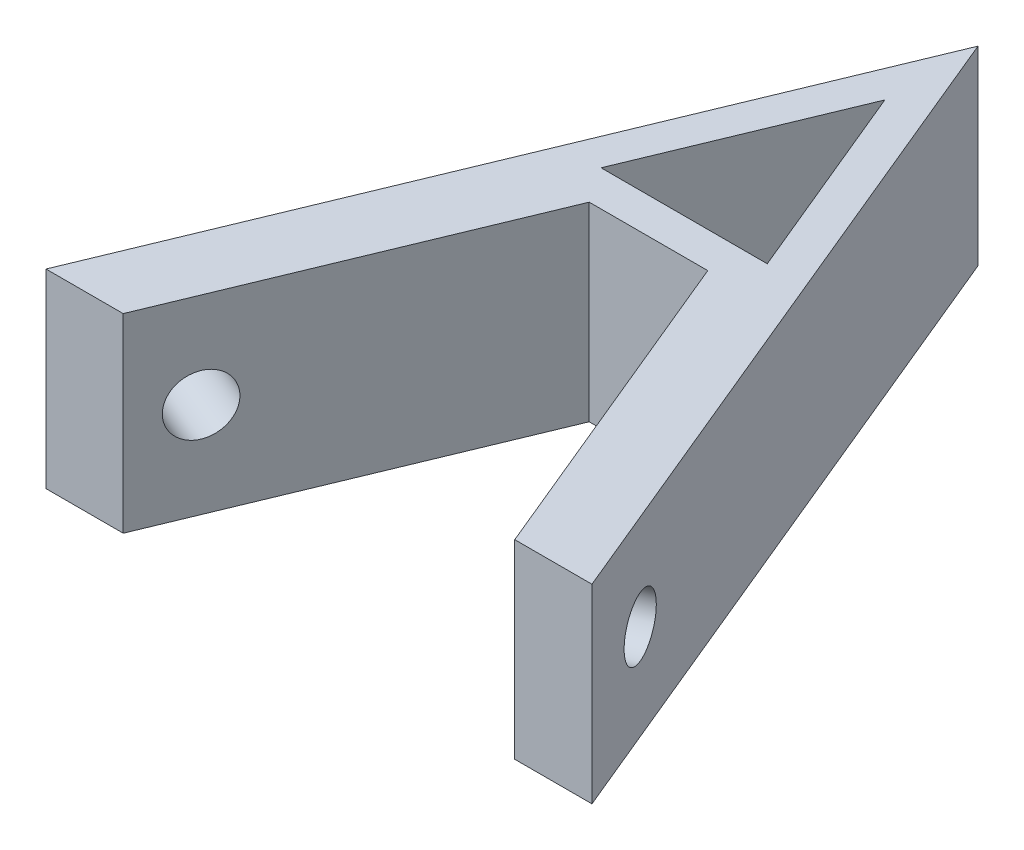
from build123d import *

# Parameters (mm, degrees)
BOSS_EXTRUDE1_DEPTH = 16
CUT_EXTRUDE1_DEPTH  = 16
SKETCH3_R           = 2.5
CUT_EXTRUDE2_DEPTH  = 16
SKETCH4_R           = 2.5
CUT_EXTRUDE3_DEPTH  = 16


with BuildPart() as part:
    # Sketch1 → Boss-Extrude1 (new body)
    with BuildSketch(Plane(origin=(0, 0, 0), x_dir=(1, 0, 0), z_dir=(0, 1, 0))):
        Polygon((0, 0), (-22.961005942, -55.432771951), (22.961005942, -55.432771951), align=None)
    extrude(amount=BOSS_EXTRUDE1_DEPTH)

    # Sketch2 → Cut-Extrude1 (cut)
    with BuildSketch(Plane(origin=(0, 16, 0), x_dir=(1, 0, 0), z_dir=(0, 1, 0))):
        Polygon((-16.46665274, -55.432771951), (-4.986149769, -27.716385975), (4.986149769, -27.716385975), (16.46665274, -55.432771951), align=None)
        Polygon((-6.990685683, -24.716385975), (6.990685683, -24.716385975), (0, -7.839377789), align=None)
    extrude(amount=-CUT_EXTRUDE1_DEPTH, mode=Mode.SUBTRACT)

    # Sketch3 → Cut-Extrude2 (cut)
    with BuildSketch(Plane(origin=(0, 0, 0), x_dir=(-0.3826834323650873, 0, -0.9238795325112878), z_dir=(0.9238795325112878, 0, -0.3826834323650873))):
        with Locations((-52.5, 8)):
            Circle(SKETCH3_R)
    extrude(amount=-CUT_EXTRUDE2_DEPTH, mode=Mode.SUBTRACT)

    # Sketch4 → Cut-Extrude3 (cut)
    with BuildSketch(Plane(origin=(0, 0, 0), x_dir=(-0.3826834323650873, 0, 0.9238795325112878), z_dir=(-0.9238795325112878, 0, -0.3826834323650873))):
        with Locations((52.5, 8)):
            Circle(SKETCH4_R)
    extrude(amount=-CUT_EXTRUDE3_DEPTH, mode=Mode.SUBTRACT)


solid = part.part
